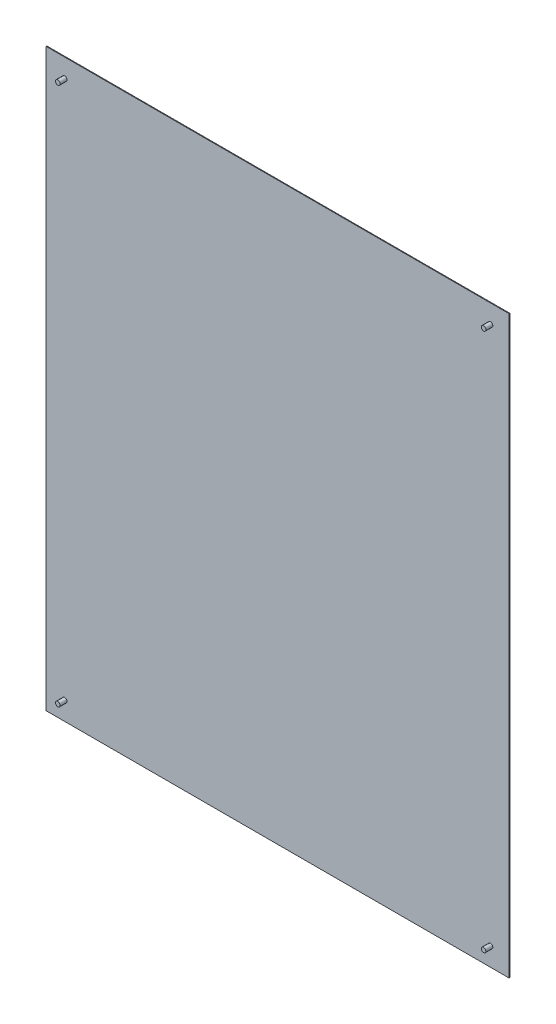
from build123d import *

# Parameters (mm, degrees)
SKETCH1_W           = 635
SKETCH1_H           = 789.432
BOSS_EXTRUDE1_DEPTH = 0.999998
SKETCH2_R           = 3.175
BOSS_EXTRUDE2_DEPTH = 9.525


with BuildPart() as part:
    # Sketch1 → Boss-Extrude1 (new body)
    with BuildSketch(Plane.XY):
        Rectangle(SKETCH1_W, SKETCH1_H)
    extrude(amount=BOSS_EXTRUDE1_DEPTH)

    # Sketch2 → Boss-Extrude2 (add, symmetric)
    with BuildSketch(Plane.XY.offset(0.999998)):
        with Locations(Location((-292.1, 369.316, 0), (0, 0, 180))):
            Circle(SKETCH2_R)
        with Locations(Location((292.1, 369.316, 0), (0, 0, 180))):
            Circle(SKETCH2_R)
        with Locations(Location((-292.1, -369.316, 0), (0, 0, 180))):
            Circle(SKETCH2_R)
        with Locations(Location((292.1, -369.316, 0), (0, 0, 180))):
            Circle(SKETCH2_R)
    extrude(amount=BOSS_EXTRUDE2_DEPTH, both=True)


solid = part.part
